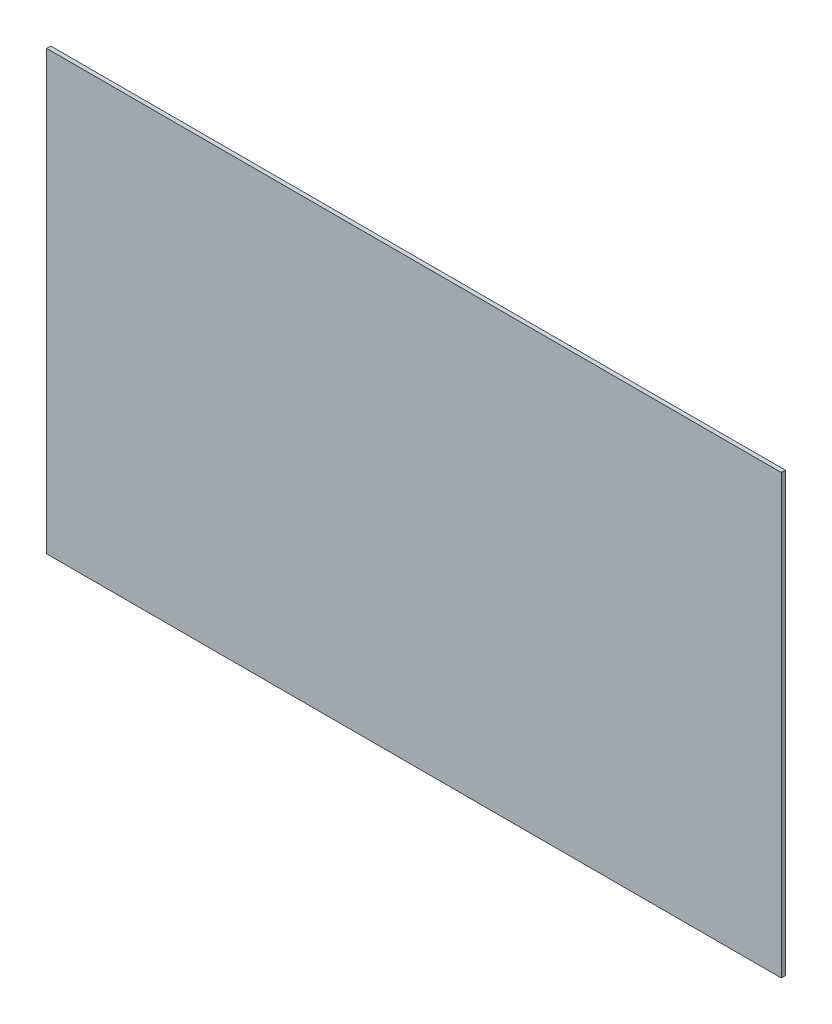
from build123d import *

# Parameters (mm, degrees)
SKETCH_1_W      = 537
SKETCH_1_H      = 320
EXTRUDE_1_DEPTH = 3


with BuildPart() as part:
    # 草图1 → 凸台-拉伸1 (new body)
    with BuildSketch(Plane.XY):
        Rectangle(SKETCH_1_W, SKETCH_1_H)
    extrude(amount=EXTRUDE_1_DEPTH)


solid = part.part
